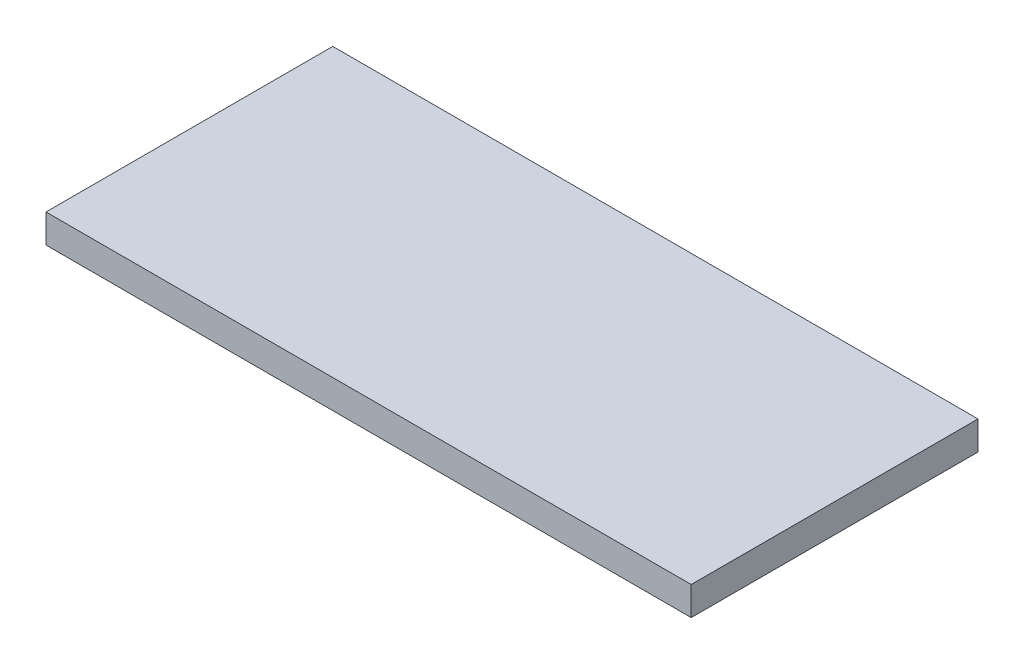
from build123d import *

# Parameters (mm, degrees)
SKETCH1_W           = 180
SKETCH1_H           = 80
BOSS_EXTRUDE1_DEPTH = 8


with BuildPart() as part:
    # Sketch1 → Boss-Extrude1 (new body)
    with BuildSketch(Plane(origin=(0, 0, 0), x_dir=(1, 0, 0), z_dir=(0, 1, 0))):
        Rectangle(SKETCH1_W, SKETCH1_H)
    extrude(amount=BOSS_EXTRUDE1_DEPTH)


solid = part.part
